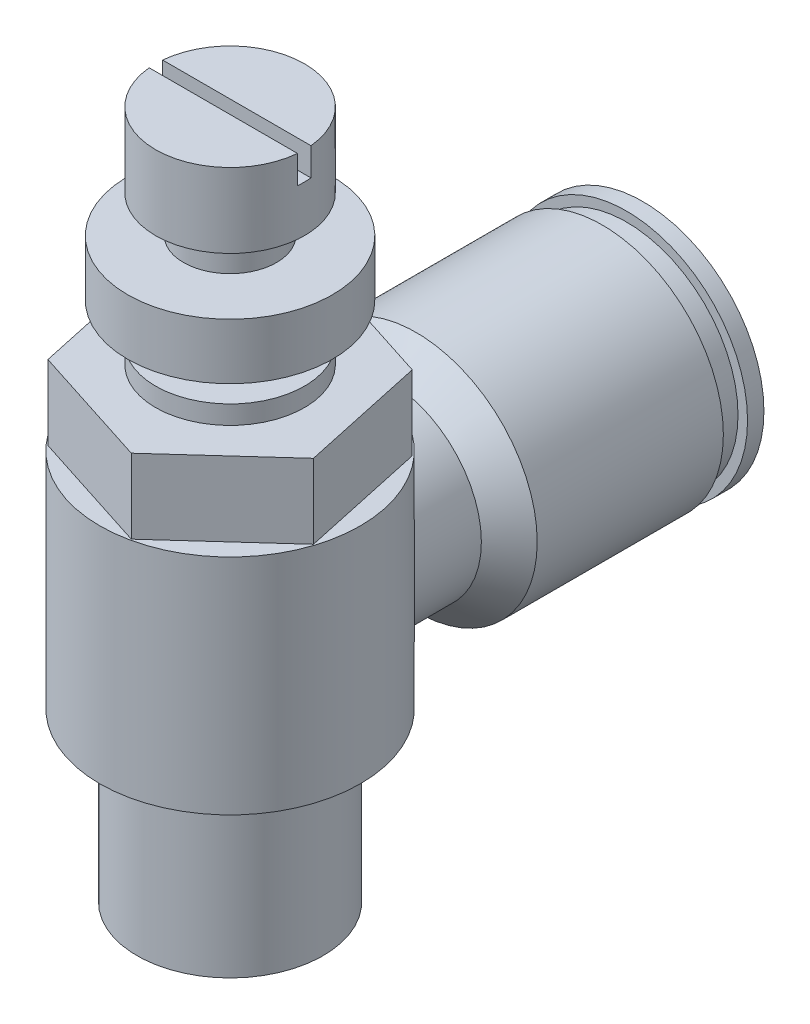
from build123d import *

# Parameters (mm, degrees)
SKETCH_1_R           = 5
EXTRUDE_1_DEPTH      = 21
EXTRUDE_2_DEPTH      = 4
SKETCH_3_R           = 4
EXTRUDE_3_DEPTH      = 1
SKETCH_4_R           = 2.5
EXTRUDE_4_DEPTH      = 7
SKETCH_5_R           = 4
EXTRUDE_5_DEPTH      = 4
SKETCH_6_R           = 5.5
EXTRUDE_6_DEPTH      = 3
SKETCH_7_R           = 7
SKETCH_7_R_2         = 5
EXTRUDE_7_DEPTH      = 12
SKETCH_9_W           = 9.328895196
SKETCH_9_H           = 0.721756852
CUT_EXTRUDE_9_DEPTH  = 1.5
SKETCH_10_R          = 4.2723733
CUT_EXTRUDE_10_DEPTH = 19


with BuildPart() as part:
    # 草图1 → 拉伸1 (new body)
    with BuildSketch(Plane(origin=(0, 0, 0), x_dir=(1, 0, 0), z_dir=(0, 1, 0))):
        with Locations(Location((0, 0, 0), (0, 0, 90))):
            Circle(SKETCH_1_R)
    extrude(amount=EXTRUDE_1_DEPTH)

    # 草图2 → 拉伸2 (add)
    with BuildSketch(Plane(origin=(0, 21, 0), x_dir=(1, 0, 0), z_dir=(0, 1, 0))):
        Polygon((5.132313302, 4.653961771), (-1.464292471, 6.771694586), (-6.596605773, 2.117732814), (-5.132313302, -4.653961771), (1.464292471, -6.771694586), (6.596605773, -2.117732814), align=None)
    extrude(amount=EXTRUDE_2_DEPTH)

    # 草图3 → 拉伸3 (add)
    with BuildSketch(Plane(origin=(0, 25, 0), x_dir=(1, 0, 0), z_dir=(0, 1, 0))):
        with Locations(Location((0, 0, 0), (0, 0, 270))):
            Circle(SKETCH_3_R)
    extrude(amount=EXTRUDE_3_DEPTH)

    # 草图4 → 拉伸4 (add)
    with BuildSketch(Plane(origin=(0, 26, 0), x_dir=(1, 0, 0), z_dir=(0, 1, 0))):
        with Locations(Location((0, 0, 0), (0, 0, 270))):
            Circle(SKETCH_4_R)
    extrude(amount=EXTRUDE_4_DEPTH)

    # 草图5 → 拉伸5 (add)
    with BuildSketch(Plane(origin=(0, 33, 0), x_dir=(1, 0, 0), z_dir=(0, 1, 0))):
        with Locations(Location((0, 0, 0), (0, 0, 270))):
            Circle(SKETCH_5_R)
    extrude(amount=EXTRUDE_5_DEPTH)

    # 草图6 → 拉伸6 (add)
    with BuildSketch(Plane(origin=(0, 28, 0), x_dir=(-1, 0, 0), z_dir=(0, 1, 0))):
        with Locations(Location((0, 0, 0), (0, 0, 90))):
            Circle(SKETCH_6_R)
    extrude(amount=EXTRUDE_6_DEPTH)



with BuildPart() as body_2:
    # 草图7 → 拉伸7 (new body)
    with BuildSketch(Plane.XZ.offset(-21)):
        with Locations(Location((0, 0, 0), (0, 0, 270))):
            Circle(SKETCH_7_R)
        with Locations(Location((0, 0, 0), (0, 0, 270))):
            Circle(SKETCH_7_R_2, mode=Mode.SUBTRACT)
    extrude(amount=EXTRUDE_7_DEPTH)


with BuildPart() as part_1:
    add(part.part)

    add(body_2.part)  # 旋转1 merges body 2
    # 草图8 → 旋转1 (revolve)
    with BuildSketch(Plane(origin=(0, 0, 0), x_dir=(0, 0, -1), z_dir=(1, 0, 0)), mode=Mode.PRIVATE) as revolve_1_sk:
        Polygon((3.877064073, 18.84702899), (3.877064073, 20), (5.073285263, 20), (8.5, 20), (10, 21.5), (20, 21.5), (20, 20.988021683), (21.3, 20.988021683), (21.3, 21.5), (22.180246255, 21.5), (22.180246255, 20), (11.774720378, 20), (9.998528163, 18.84702899), align=None)
    revolve(revolve_1_sk.sketch.rotate(Axis((0, 15, 0), (0, 0, -1)), 90), axis=Axis((0, 15, 0), (0, 0, -1)))

    # 草图9 → 拉伸9 (cut)
    with BuildSketch(Plane(origin=(0, 37, 0), x_dir=(1, 0, 0), z_dir=(0, 1, 0))):
        Rectangle(SKETCH_9_W, SKETCH_9_H)
    extrude(amount=-CUT_EXTRUDE_9_DEPTH, mode=Mode.SUBTRACT)

    # 草图10 → 拉伸10 (cut)
    with BuildSketch(Plane.XZ):
        with Locations(Location((0, 0, 0), (0, 0, 270))):
            Circle(SKETCH_10_R)
    extrude(amount=-CUT_EXTRUDE_10_DEPTH, mode=Mode.SUBTRACT)


solid = part_1.part
